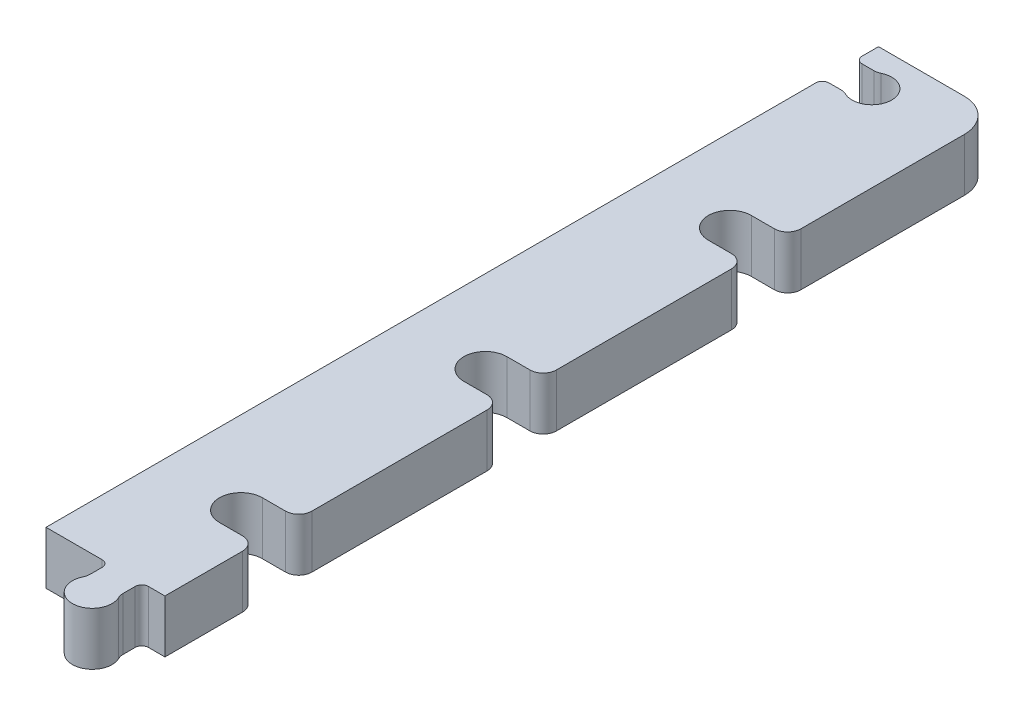
from build123d import *

# Parameters (mm, degrees)
SKETCH_1_W          = 18
SKETCH_1_H          = 126
EXTRUDE_1_DEPTH     = 8
CUT_EXTRUDE_1_DEPTH = 10
FILLET_1_R          = 5
FILLET_2_R          = 2
EXTRUDE_5_DEPTH     = 8
CUT_EXTRUDE_4_DEPTH = 8
FILLET_3_R          = 1
FILLET_4_R          = 1


with BuildPart() as part:
    # 스케치1 → 보스-돌출1 (new body)
    with BuildSketch(Plane(origin=(0, 0, 0), x_dir=(1, 0, 0), z_dir=(0, 1, 0))):
        with Locations((9, 63)):
            Rectangle(SKETCH_1_W, SKETCH_1_H)
    extrude(amount=EXTRUDE_1_DEPTH)

    # 스케치2 → 컷-돌출1 (cut)
    with BuildSketch(Plane(origin=(0, 8, 0), x_dir=(1, 0, 0), z_dir=(0, 1, 0))):
        with BuildLine():
            Line((12.5, 94.25), (18, 94.25))
            ThreePointArc((18, 94.25), (21.25, 91), (18, 87.75))
            Line((18, 87.75), (12.5, 87.75))
            ThreePointArc((12.5, 87.75), (9.25, 91), (12.5, 94.25))
        make_face()
        with BuildLine():
            Line((12.5, 57.25), (18, 57.25))
            ThreePointArc((18, 57.25), (21.25, 54), (18, 50.75))
            Line((18, 50.75), (12.5, 50.75))
            ThreePointArc((12.5, 50.75), (9.25, 54), (12.5, 57.25))
        make_face()
        with BuildLine():
            Line((12.5, 20.25), (18, 20.25))
            ThreePointArc((18, 20.25), (21.25, 17), (18, 13.75))
            Line((18, 13.75), (12.5, 13.75))
            ThreePointArc((12.5, 13.75), (9.25, 17), (12.5, 20.25))
        make_face()
    extrude(amount=-CUT_EXTRUDE_1_DEPTH, mode=Mode.SUBTRACT)

    # 필렛1
    fillet_1_edges = [part.edges().sort_by_distance(p)[0] for p in [
        (18, 4, -126),
    ]]
    fillet(fillet_1_edges, radius=FILLET_1_R)

    # 필렛2
    fillet_2_edges = [part.edges().sort_by_distance(p)[0] for p in [
        (18, 4, -94.25),
        (18, 4, -87.75),
        (18, 4, -57.25),
        (18, 4, -50.75),
        (18, 4, -20.25),
        (18, 4, -13.75),
    ]]
    fillet(fillet_2_edges, radius=FILLET_2_R)

    # 스케치10 → 보스-돌출5 (add)
    with BuildSketch(Plane.XZ):
        with BuildLine():
            Line((9.5, 0), (9.5, 2.820550528))
            ThreePointArc((9.5, 2.820550528), (9.449358869, 3.267764124), (9.3, 3.692330317))
            ThreePointArc((9.3, 3.692330317), (12, 8), (14.7, 3.692330317))
            ThreePointArc((14.7, 3.692330317), (14.550641131, 3.267764124), (14.5, 2.820550528))
            Line((14.5, 2.820550528), (14.5, 0))
            Line((14.5, 0), (9.5, 0))
        make_face()
    extrude(amount=-EXTRUDE_5_DEPTH)

    # 스케치11 → 컷-돌출4 (cut)
    with BuildSketch(Plane.XZ):
        with BuildLine():
            Line((0, -117.5), (2.820550528, -117.5))
            ThreePointArc((2.820550528, -117.5), (3.267764124, -117.449358869), (3.692330317, -117.3))
            ThreePointArc((3.692330317, -117.3), (8, -120), (3.692330317, -122.7))
            ThreePointArc((3.692330317, -122.7), (3.267764124, -122.550641131), (2.820550528, -122.5))
            Line((2.820550528, -122.5), (0, -122.5))
            Line((0, -122.5), (0, -117.5))
        make_face()
    extrude(amount=-CUT_EXTRUDE_4_DEPTH, mode=Mode.SUBTRACT)

    # 필렛3
    fillet_3_edges = [part.edges().sort_by_distance(p)[0] for p in [
        (9.5, 4, 0),
        (14.5, 4, 0),
    ]]
    fillet(fillet_3_edges, radius=FILLET_3_R)

    # 필렛4
    fillet_4_edges = [part.edges().sort_by_distance(p)[0] for p in [
        (0, 4, -122.5),
        (0, 4, -117.5),
    ]]
    fillet(fillet_4_edges, radius=FILLET_4_R)


solid = part.part
